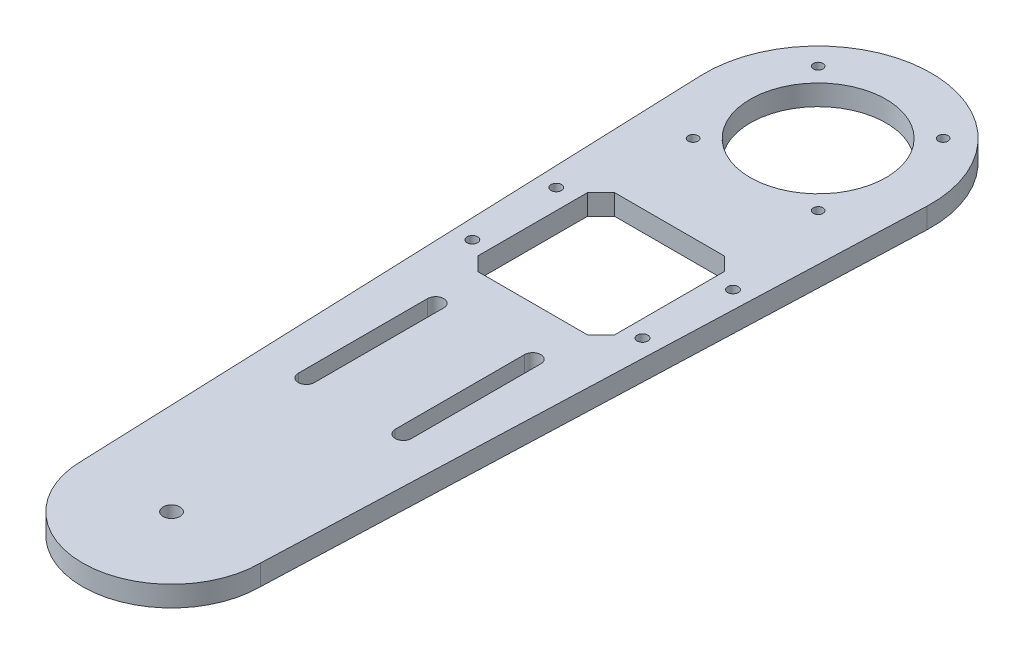
from build123d import *

# Parameters (mm, degrees)
BOSS_EXTRUDE1_DEPTH     = 6.35
SKETCH2_R               = 2.6
CUT_EXTRUDE1_DEPTH      = 238.676928834
ESQUISSE3_R             = 21
ENL_V_MAT_EXTRU_2_DEPTH = 238.676928834
ESQUISSE7_R             = 1.5
ENL_V_MAT_EXTRU_3_DEPTH = 238.676928834
CUT_EXTRUDE2_DEPTH      = 238.676928834
SKETCH5_R               = 1.625
CUT_EXTRUDE3_DEPTH      = 238.676928834
CUT_EXTRUDE5_DEPTH      = 238.676928834


with BuildPart() as part:
    # Sketch1 → Boss-Extrude1 (new body)
    with BuildSketch(Plane(origin=(0, 0, 0), x_dir=(1, 0, 0), z_dir=(0, 1, 0))):
        with BuildLine():
            Line((27.5, 0), (34.975254116, 198.684097441))
            ThreePointArc((34.975254116, 198.684097441), (0, 235), (-34.975254116, 198.684097441))
            Line((-34.975254116, 198.684097441), (-27.5, 0))
            ThreePointArc((-27.5, 0), (0, -27.5), (27.5, 0))
        make_face()
    extrude(amount=BOSS_EXTRUDE1_DEPTH)

    # Sketch2 → Cut-Extrude1 (cut, through all)
    with BuildSketch(Plane(origin=(0, 6.35, 0), x_dir=(1, 0, 0), z_dir=(0, 1, 0))):
        with Locations(Location((0, 0, 0), (0, 0, 270))):
            Circle(SKETCH2_R)
    extrude(amount=-CUT_EXTRUDE1_DEPTH, mode=Mode.SUBTRACT)

    # Esquisse3 → Enlèv. mat.-Extru.2 (cut, through all)
    with BuildSketch(Plane(origin=(0, 6.35, 0), x_dir=(1, 0, 0), z_dir=(0, 1, 0))):
        with Locations(Location((0, 200, 0), (0, 0, 270))):
            Circle(ESQUISSE3_R)
    extrude(amount=-ENL_V_MAT_EXTRU_2_DEPTH, mode=Mode.SUBTRACT)

    # Esquisse7 → Enlèv. mat.-Extru.3 (cut, through all)
    with BuildSketch(Plane(origin=(0, 6.35, 0), x_dir=(1, 0, 0), z_dir=(0, 1, 0))):
        with Locations(Location((-19.339370465, 219.339370465, 0), (0, 0, 270))):
            Circle(ESQUISSE7_R)
        with Locations(Location((19.339370465, 219.339370465, 0), (0, 0, 270))):
            Circle(ESQUISSE7_R)
        with Locations(Location((19.339370465, 180.660629535, 0), (0, 0, 270))):
            Circle(ESQUISSE7_R)
        with Locations(Location((-19.339370465, 180.660629535, 0), (0, 0, 270))):
            Circle(ESQUISSE7_R)
    extrude(amount=-ENL_V_MAT_EXTRU_3_DEPTH, mode=Mode.SUBTRACT)

    # Sketch3 → Cut-Extrude2 (cut, through all)
    with BuildSketch(Plane(origin=(0, 6.35, 0), x_dir=(1, 0, 0), z_dir=(0, 1, 0))):
        Polygon((21.15, 149.828069991), (21.15, 115.871930009), (16.978069991, 111.7), (-16.978069991, 111.7), (-21.15, 115.871930009), (-21.15, 149.828069991), (-16.978069991, 154), (16.978069991, 154), align=None)
    extrude(amount=-CUT_EXTRUDE2_DEPTH, mode=Mode.SUBTRACT)

    # Sketch5 → Cut-Extrude3 (cut, through all)
    with BuildSketch(Plane(origin=(0, 6.35, 0), x_dir=(1, 0, 0), z_dir=(0, 1, 0))):
        with Locations(Location((-27.331724457, 146.340455159, 0), (0, 0, 270))):
            Circle(SKETCH5_R)
        with Locations(Location((-26.316599626, 119.359544841, 0), (0, 0, 270))):
            Circle(SKETCH5_R)
    cut_extrude3 = extrude(amount=-CUT_EXTRUDE3_DEPTH, mode=Mode.SUBTRACT)

    # Mirror1: Cut-Extrude3 across plane
    add(cut_extrude3.mirror(Plane(origin=(0, 0, 0), x_dir=(0, 0, 1), z_dir=(1, 0, 0))), mode=Mode.SUBTRACT)

    # Sketch8 → Cut-Extrude5 (cut, through all)
    with BuildSketch(Plane(origin=(0, 6.35, 0), x_dir=(1, 0, 0), z_dir=(0, 1, 0))):
        with BuildLine():
            Line((-12.5, 96.7), (-12.5, 56.7))
            ThreePointArc((-12.5, 56.7), (-15, 54.2), (-17.5, 56.7))
            Line((-17.5, 56.7), (-17.5, 96.7))
            ThreePointArc((-17.5, 96.7), (-15, 99.2), (-12.5, 96.7))
        make_face()
    cut_extrude5 = extrude(amount=-CUT_EXTRUDE5_DEPTH, mode=Mode.SUBTRACT)

    # Mirror2: Cut-Extrude5 across plane
    add(cut_extrude5.mirror(Plane(origin=(0, 0, 0), x_dir=(0, 0, 1), z_dir=(1, 0, 0))), mode=Mode.SUBTRACT)


solid = part.part
